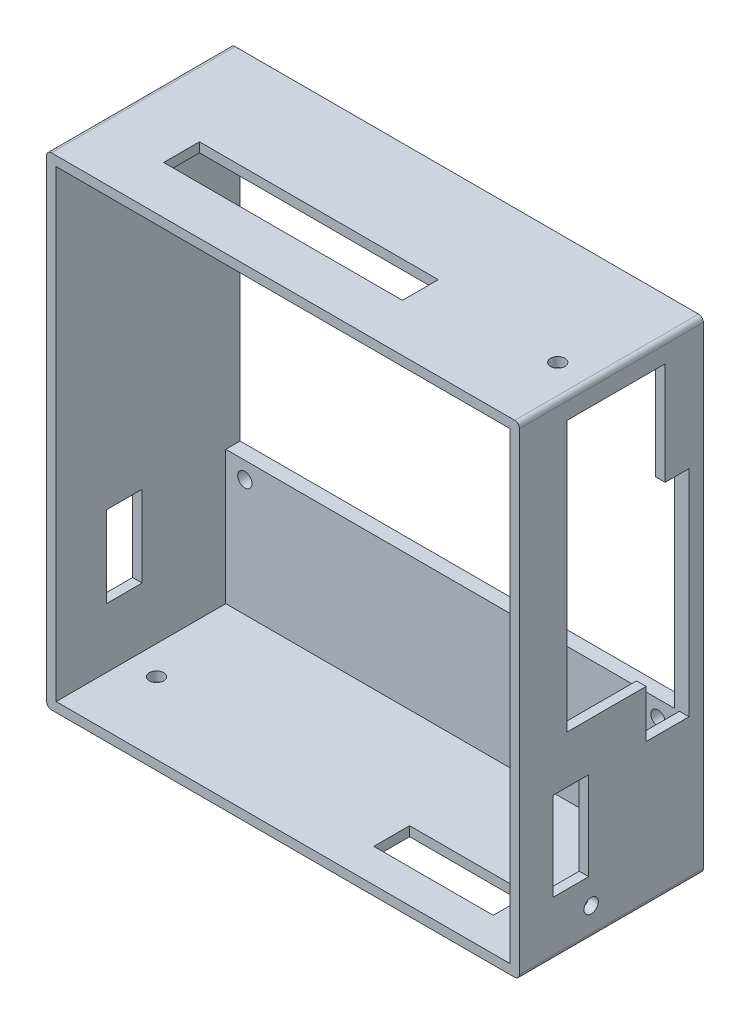
from build123d import *

# Parameters (mm, degrees)
SKETCH_1_W           = 99
SKETCH_1_H           = 104
SKETCH_1_R           = 1.5
SKETCH_1_W_2         = 95
SKETCH_1_H_2         = 61
EXTRUDE_3_DEPTH      = 3
SKETCH_3_W           = 99
SKETCH_3_H           = 104
SKETCH_3_W_2         = 95
SKETCH_3_H_2         = 100
EXTRUDE_4_DEPTH      = 33
CUT_EXTRUDE_2_DEPTH  = 30
SKETCH_5_W           = 50
SKETCH_5_H           = 7.5
CUT_EXTRUDE_3_DEPTH  = 30
SKETCH_6_W           = 28
SKETCH_6_H           = 55
CUT_EXTRUDE_4_DEPTH  = 30
SKETCH_7_W           = 7.5
SKETCH_7_H           = 18.5
CUT_EXTRUDE_5_DEPTH  = 30
SKETCH_8_W           = 25
SKETCH_8_H           = 7.5
CUT_EXTRUDE_6_DEPTH  = 30
FILLET_1_R           = 1
SKETCH_9_W           = 2
SKETCH_9_H           = 55
EXTRUDE_5_DEPTH      = 7.5
SKETCH_14_W          = 95
SKETCH_14_H          = 33
SKETCH_14_W_2        = 25
SKETCH_14_H_2        = 7.5
EXTRUDE_6_DEPTH      = 3
SKETCH_15_W          = 178.19226754
SKETCH_15_H          = 134.394802541
CUT_EXTRUDE_8_DEPTH  = 3
EXTRUDE_7_DEPTH      = 3
SKETCH_17_W          = 7.5
SKETCH_17_H          = 17
CUT_EXTRUDE_9_DEPTH  = 3
FILLET_3_R           = 1
SKETCH_19_W          = 95
SKETCH_19_H          = 97
EXTRUDE_8_DEPTH      = 2.5
SKETCH_20_W          = 2
SKETCH_20_H          = 20.5
EXTRUDE_9_DEPTH      = 2.5
CUT_EXTRUDE_10_DEPTH = 2
EXTRUDE_11_DEPTH     = 2
SKETCH_24_R          = 1.5
CUT_EXTRUDE_11_DEPTH = 2
SKETCH_25_R          = 1.5
CUT_EXTRUDE_12_DEPTH = 2
SKETCH_26_R          = 1.5
CUT_EXTRUDE_13_DEPTH = 2
SKETCH_27_R          = 1.5
CUT_EXTRUDE_14_DEPTH = 2
SKETCH_28_W          = 2
SKETCH_28_H          = 16.5
CUT_EXTRUDE_15_DEPTH = 4
SKETCH_29_W          = 6
SKETCH_29_H          = 7.5
EXTRUDE_12_DEPTH     = 2
SKETCH_30_W          = 6
SKETCH_30_H          = 7.5
CUT_EXTRUDE_16_DEPTH = 2


with BuildPart() as part:
    # 草图1 → 凸台-拉伸3 (new body)
    with BuildSketch(Plane.XY):
        with Locations((0, -11.5)):
            Rectangle(SKETCH_1_W, SKETCH_1_H)
        with Locations((43, 34)):
            Circle(SKETCH_1_R, mode=Mode.SUBTRACT)
        with Locations(Location((-43.5, 34, 0), (0, 0, 180))):
            Circle(SKETCH_1_R, mode=Mode.SUBTRACT)
        with Locations((-43.5, -34)):
            Circle(SKETCH_1_R, mode=Mode.SUBTRACT)
        with Locations(Location((43, -34, 0), (0, 0, 180))):
            Circle(SKETCH_1_R, mode=Mode.SUBTRACT)
        Rectangle(SKETCH_1_W_2, SKETCH_1_H_2, mode=Mode.SUBTRACT)
    extrude(amount=EXTRUDE_3_DEPTH)

    # 草图3 → 凸台-拉伸4 (add)
    with BuildSketch(Plane.XY.offset(3)):
        with Locations((0, -11.5)):
            Rectangle(SKETCH_3_W, SKETCH_3_H)
        with Locations((0, -11.5)):
            Rectangle(SKETCH_3_W_2, SKETCH_3_H_2, mode=Mode.SUBTRACT)
    extrude(amount=EXTRUDE_4_DEPTH)

    # 草图4 → 切除-拉伸2 (cut)
    with BuildSketch(Plane.ZY.offset(-47.5)):
        Polygon((12, 14.5), (12, -30.5), (3, -30.5), (0, -30.5), (0, 14.5), align=None)
    extrude(amount=-CUT_EXTRUDE_2_DEPTH, mode=Mode.SUBTRACT)

    # 草图5 → 切除-拉伸3 (cut)
    with BuildSketch(Plane(origin=(0, 40.5, 0), x_dir=(1, 0, 0), z_dir=(0, 1, 0))):
        with Locations((-10, -24.75)):
            Rectangle(SKETCH_5_W, SKETCH_5_H)
    extrude(amount=-CUT_EXTRUDE_3_DEPTH, mode=Mode.SUBTRACT)

    # 草图6 → 切除-拉伸4 (cut)
    with BuildSketch(Plane.ZY.offset(-47.5)):
        with Locations((22, 11)):
            Rectangle(SKETCH_6_W, SKETCH_6_H)
    extrude(amount=-CUT_EXTRUDE_4_DEPTH, mode=Mode.SUBTRACT)

    # 草图7 → 切除-拉伸5 (cut)
    with BuildSketch(Plane.ZY.offset(-47.5)):
        with Locations((27.75, -39.75)):
            Rectangle(SKETCH_7_W, SKETCH_7_H)
    extrude(amount=-CUT_EXTRUDE_5_DEPTH, mode=Mode.SUBTRACT)

    # 草图8 → 切除-拉伸6 (cut)
    with BuildSketch(Plane(origin=(0, -61.5, 0), x_dir=(1, 0, 0), z_dir=(0, 1, 0))):
        with Locations((27.5, -24.75)):
            Rectangle(SKETCH_8_W, SKETCH_8_H)
    extrude(amount=-CUT_EXTRUDE_6_DEPTH, mode=Mode.SUBTRACT)

    # 圆角1
    fillet_1_edges = [part.edges().sort_by_distance(p)[0] for p in [
        (-49.5, 40.5, 18),
        (49.5, 40.5, 18),
        (49.5, -63.5, 18),
        (-49.5, -63.5, 18),
    ]]
    fillet(fillet_1_edges, radius=FILLET_1_R)

    # 草图9 → 凸台-拉伸5 (add)
    with BuildSketch(Plane.XY.offset(36)):
        with Locations((48.5, 11)):
            Rectangle(SKETCH_9_W, SKETCH_9_H)
    extrude(amount=-EXTRUDE_5_DEPTH)

    # 草图14 → 凸台-拉伸6 (add)
    with BuildSketch(Plane(origin=(0, -61.5, 0), x_dir=(1, 0, 0), z_dir=(0, 1, 0))):
        with Locations((0, -19.5)):
            Rectangle(SKETCH_14_W, SKETCH_14_H)
        with Locations((27.5, -24.75)):
            Rectangle(SKETCH_14_W_2, SKETCH_14_H_2, mode=Mode.SUBTRACT)
    extrude(amount=EXTRUDE_6_DEPTH)

    # 草图15 → 切除-拉伸8 (cut)
    with BuildSketch(Plane.XZ.offset(63.5)):
        with Locations((3.050514682, 15.901855456)):
            Rectangle(SKETCH_15_W, SKETCH_15_H)
    extrude(amount=-CUT_EXTRUDE_8_DEPTH, mode=Mode.SUBTRACT)

    # 草图16 → 凸台-拉伸7 (add)
    with BuildSketch(Plane(origin=(0, 0, 0), x_dir=(-1, 0, 0), z_dir=(0, 0, -1))):
        Polygon((-47.5, 30.5), (-46.5, 30.5), (-46.5, -30.5), (-49.5, -30.5), (-49.5, 14.5), (-47.5, 14.5), align=None)
    extrude(amount=-EXTRUDE_7_DEPTH)

    # 草图17 → 切除-拉伸9 (cut)
    with BuildSketch(Plane.ZY.offset(49.5)):
        with Locations((24.25, -37.5)):
            Rectangle(SKETCH_17_W, SKETCH_17_H)
    extrude(amount=-CUT_EXTRUDE_9_DEPTH, mode=Mode.SUBTRACT)

    # 圆角3
    fillet_3_edges = [part.edges().sort_by_distance(p)[0] for p in [
        (49.5, -60.5, 18),
        (-49.5, -60.5, 18),
    ]]
    fillet(fillet_3_edges, radius=FILLET_3_R)

    # 草图19 → 凸台-拉伸8 (add)
    with BuildSketch(Plane.XY.offset(36)):
        with BuildLine():
            Line((-49.5, 39.5), (-49.5, -59.5))
            ThreePointArc((-49.5, -59.5), (-49.207106781, -60.207106781), (-48.5, -60.5))
            Line((-48.5, -60.5), (48.5, -60.5))
            ThreePointArc((48.5, -60.5), (49.207106781, -60.207106781), (49.5, -59.5))
            Line((49.5, -59.5), (49.5, 39.5))
            ThreePointArc((49.5, 39.5), (49.207106781, 40.207106781), (48.5, 40.5))
            Line((48.5, 40.5), (-48.5, 40.5))
            ThreePointArc((-48.5, 40.5), (-49.207106781, 40.207106781), (-49.5, 39.5))
        make_face()
        with Locations((0, -10)):
            Rectangle(SKETCH_19_W, SKETCH_19_H, mode=Mode.SUBTRACT)
    extrude(amount=EXTRUDE_8_DEPTH)

    # 草图20 → 凸台-拉伸9 (add)
    with BuildSketch(Plane.XZ.offset(-38.5)):
        with Locations((48.5, 18.25)):
            Rectangle(SKETCH_20_W, SKETCH_20_H)
    extrude(amount=EXTRUDE_9_DEPTH)

    # 草图21 → 切除-拉伸10 (cut)
    with BuildSketch(Plane.XZ.offset(60.5)):
        Polygon((43, 24), (43, 31.5), (18, 31.5), (18, 28.5), (40, 28.5), (40, 24), align=None)
    extrude(amount=-CUT_EXTRUDE_10_DEPTH, mode=Mode.SUBTRACT)

    # 草图23 → 凸台-拉伸11 (add)
    with BuildSketch(Plane.XZ.offset(60.5)):
        Polygon((15, 28.5), (18, 28.5), (18, 24), (40, 24), (40, 21), (15, 21), align=None)
    extrude(amount=-EXTRUDE_11_DEPTH)

    # 草图24 → 切除-拉伸11 (cut)
    with BuildSketch(Plane(origin=(49.5, 0, 0), x_dir=(0, 0, -1), z_dir=(1, 0, 0))):
        with Locations((-23.5, -54.5)):
            Circle(SKETCH_24_R)
    extrude(amount=-CUT_EXTRUDE_11_DEPTH, mode=Mode.SUBTRACT)

    # 草图25 → 切除-拉伸12 (cut)
    with BuildSketch(Plane.XZ.offset(60.5)):
        with Locations(Location((-41.5, 23.5, 0), (0, 0, 270))):
            Circle(SKETCH_25_R)
    extrude(amount=-CUT_EXTRUDE_12_DEPTH, mode=Mode.SUBTRACT)

    # 草图26 → 切除-拉伸13 (cut)
    with BuildSketch(Plane.ZY.offset(49.5)):
        with Locations((23.5, 33.5)):
            Circle(SKETCH_26_R)
    extrude(amount=-CUT_EXTRUDE_13_DEPTH, mode=Mode.SUBTRACT)

    # 草图27 → 切除-拉伸14 (cut)
    with BuildSketch(Plane(origin=(0, 40.5, 0), x_dir=(1, 0, 0), z_dir=(0, 1, 0))):
        with Locations(Location((42.5, -23.5, 0), (0, 0, 270))):
            Circle(SKETCH_27_R)
    extrude(amount=-CUT_EXTRUDE_14_DEPTH, mode=Mode.SUBTRACT)

    # 草图28 → 切除-拉伸15 (cut)
    with BuildSketch(Plane(origin=(0, -16.5, 0), x_dir=(1, 0, 0), z_dir=(0, 1, 0))):
        with Locations((48.5, -20.25)):
            Rectangle(SKETCH_28_W, SKETCH_28_H)
    extrude(amount=-CUT_EXTRUDE_15_DEPTH, mode=Mode.SUBTRACT)

    # 草图29 → 凸台-拉伸12 (add)
    with BuildSketch(Plane.XZ.offset(60.5)):
        with Locations((40, 27.75)):
            Rectangle(SKETCH_29_W, SKETCH_29_H)
    extrude(amount=-EXTRUDE_12_DEPTH)

    # 草图30 → 切除-拉伸16 (cut)
    with BuildSketch(Plane.XZ.offset(60.5)):
        with Locations((15, 27.75)):
            Rectangle(SKETCH_30_W, SKETCH_30_H)
    extrude(amount=-CUT_EXTRUDE_16_DEPTH, mode=Mode.SUBTRACT)


solid = part.part
